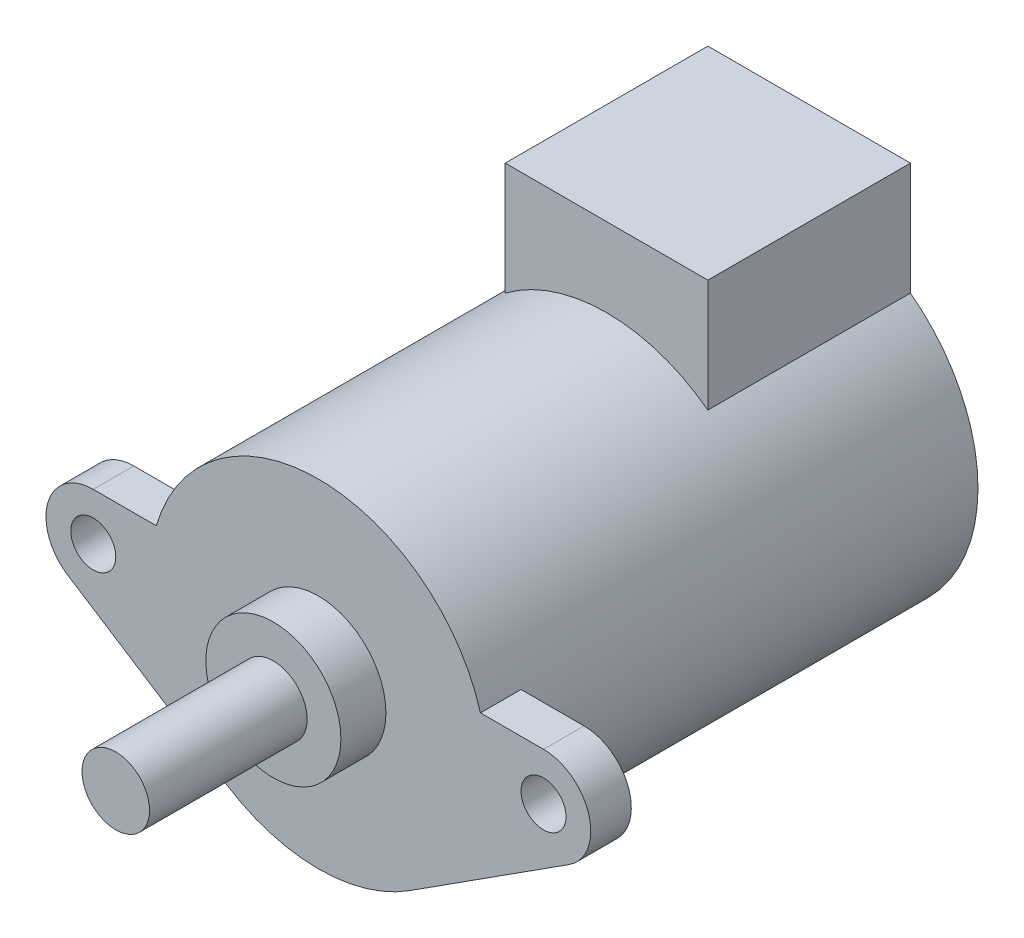
from build123d import *

# Parameters (mm, degrees)
SCHIZZO1_W                        = 7.5
SCHIZZO1_H                        = 21.8
ESTRUSIONE_ESTRUSIONE1_START      = -1.8
ESTRUSIONE_ESTRUSIONE1_DEPTH      = 1.8
ESTRUSIONE_ESTRUSIONE2_START      = -1.8
ESTRUSIONE_ESTRUSIONE2_DEPTH      = 1.8
SCHIZZO4_R                        = 3
ESTRUSIONE_ESTRUSIONE3_DEPTH      = 2
SCHIZZO5_R                        = 1.5
ESTRUSIONE_ESTRUSIONE4_DEPTH      = 7
ESTRUSIONE_ESTRUSIONE5_REACH      = 31.81
ESTRUSIONE_ESTRUSIONE5_END_RADIUS = 7.5
SCHIZZO6_W                        = 9
SCHIZZO6_H                        = 9
SCHIZZO7_R                        = 1
ESTRUSIONE_ESTRUSIONE6_DEPTH      = 1.5
FORO1_D                           = 2
FORO1_DEPTH                       = 10.8
FORO2_D                           = 2
FORO2_DEPTH                       = 10.8


with BuildPart() as part:
    # Schizzo1 → Rivoluzione1 (revolve)
    with BuildSketch(Plane(origin=(0, 0, 0), x_dir=(1, 0, 0), z_dir=(0, 1, 0))):
        with Locations((3.75, 9.1)):
            Rectangle(SCHIZZO1_W, SCHIZZO1_H)
    revolve(axis=Axis((0, 0, -20), (0, 0, 1)))

    # Schizzo2 → Estrusione-Estrusione1 (add)
    with BuildSketch(Plane.XY.offset(1.8).offset(ESTRUSIONE_ESTRUSIONE1_START)):
        with BuildLine():
            Line((-11.134, -1.767496535), (-4.05, -6.312487624))
            ThreePointArc((-4.05, -6.312487624), (-7.023753413, -2.629997718), (-7.2, 2.1))
            Line((-7.2, 2.1), (-10, 2.1))
            ThreePointArc((-10, 2.1), (-12.015160381, 0.590871085), (-11.134, -1.767496535))
        make_face()
    extrude(amount=ESTRUSIONE_ESTRUSIONE1_DEPTH)

    # Schizzo3 → Estrusione-Estrusione2 (add)
    with BuildSketch(Plane.XY.offset(1.8).offset(ESTRUSIONE_ESTRUSIONE2_START)):
        with BuildLine():
            Line((10, 2.1), (7.2, 2.1))
            ThreePointArc((7.2, 2.1), (7.023753413, -2.629997718), (4.05, -6.312487624))
            Line((4.05, -6.312487624), (11.134, -1.767496535))
            ThreePointArc((11.134, -1.767496535), (12.015160381, 0.590871085), (10, 2.1))
        make_face()
    extrude(amount=ESTRUSIONE_ESTRUSIONE2_DEPTH)

    # Schizzo4 → Estrusione-Estrusione3 (add)
    with BuildSketch(Plane.XY.offset(1.8)):
        Circle(SCHIZZO4_R)
    extrude(amount=ESTRUSIONE_ESTRUSIONE3_DEPTH)

    # Schizzo5 → Estrusione-Estrusione4 (add)
    with BuildSketch(Plane.XY.offset(3.8)):
        Circle(SCHIZZO5_R)
    extrude(amount=ESTRUSIONE_ESTRUSIONE4_DEPTH)

    # Estrusione-Estrusione5: up to this cylinder (the profile starts outside it)
    estrusione_estrusione5_end = Plane(origin=(0, 0, -15.5), z_dir=(0, 0, 1)) * Cylinder(ESTRUSIONE_ESTRUSIONE5_END_RADIUS, 79.62, mode=Mode.PRIVATE)
    # Schizzo6 → Estrusione-Estrusione5 (add, up to the surface)
    with BuildSketch(Plane(origin=(0, 11, 0), x_dir=(-1, 0, 0), z_dir=(0, 1, 0)), mode=Mode.PRIVATE) as estrusione_estrusione5_sk1:
        with Locations((0, -15.5)):
            Rectangle(SCHIZZO6_W, SCHIZZO6_H)
    estrusione_estrusione5_tool1 = extrude(estrusione_estrusione5_sk1.sketch, amount=-ESTRUSIONE_ESTRUSIONE5_REACH, mode=Mode.PRIVATE) - estrusione_estrusione5_end
    add(estrusione_estrusione5_tool1.solids().sort_by_distance((0, 11, -15.5))[0])

    # Schizzo7 → Estrusione-Estrusione6 (add)
    with BuildSketch(Plane(origin=(0, 0, -20), x_dir=(-1, 0, 0), z_dir=(0, 0, -1))):
        Circle(SCHIZZO7_R)
    extrude(amount=ESTRUSIONE_ESTRUSIONE6_DEPTH)

    # Foro1
    with Locations(Plane(origin=(0, 0, 0), x_dir=(-1, 0, 0), z_dir=(0, 0, -1))):
        with Locations((-10, 0)):
            Hole(FORO1_D / 2, depth=FORO1_DEPTH)

    # Foro2
    with Locations(Plane(origin=(0, 0, 0), x_dir=(-1, 0, 0), z_dir=(0, 0, -1))):
        with Locations((10, 0)):
            Hole(FORO2_D / 2, depth=FORO2_DEPTH)


solid = part.part
